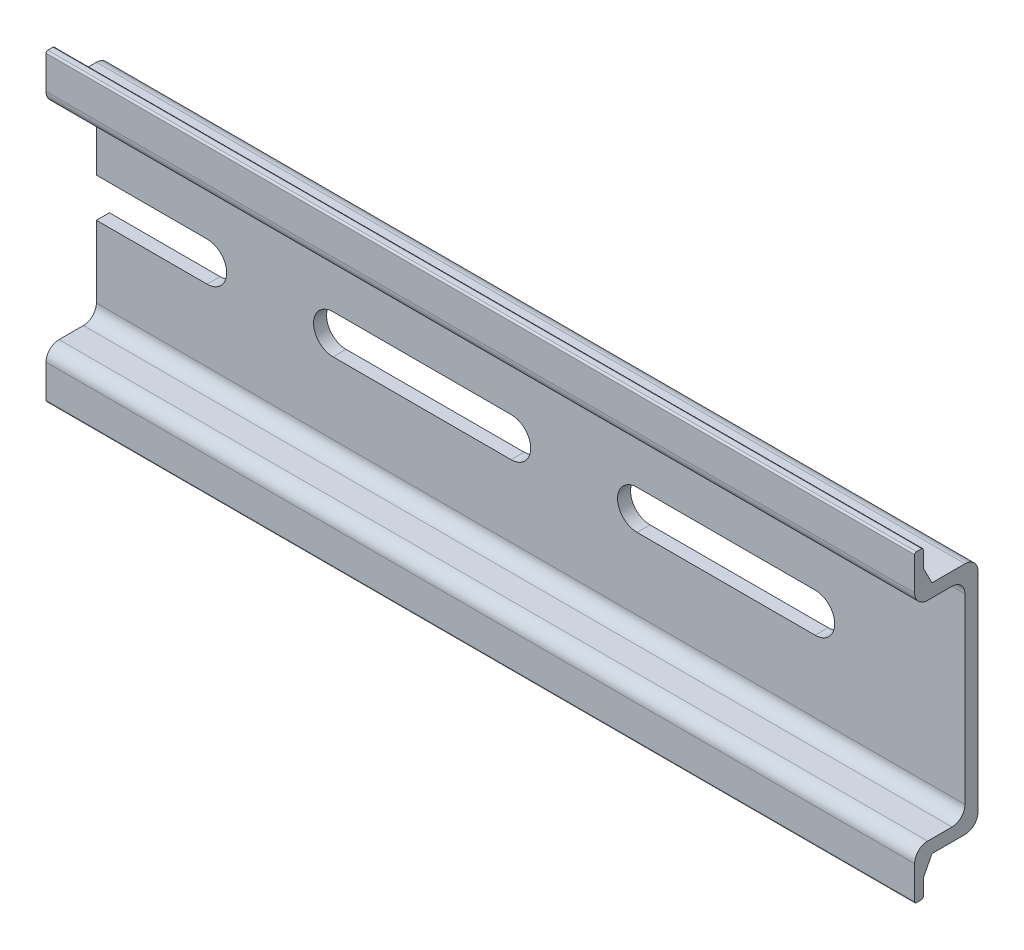
from build123d import *

# Parameters (mm, degrees)
BOSS_EXTRUDE1_DEPTH = 100
CUT_EXTRUDE1_DEPTH  = 102.78182549
LPATTERN1_COUNT     = 3
LPATTERN1_PITCH     = 35


with BuildPart() as part:
    # Sketch1 → Boss-Extrude1 (new body)
    with BuildSketch(Plane(origin=(0, 0, 0), x_dir=(0, 0, -1), z_dir=(1, 0, 0))):
        with BuildLine():
            Line((-6.5, 17.5), (-7.1, 17.5))
            ThreePointArc((-7.1, 17.5), (-7.241421356, 17.441421356), (-7.3, 17.3))
            Line((-7.3, 17.3), (-7.3, 13.5))
            ThreePointArc((-7.3, 13.5), (-6.860660172, 12.439339828), (-5.8, 12))
            Line((-5.8, 12), (-3, 12))
            ThreePointArc((-3, 12), (-1.939339828, 11.560660172), (-1.5, 10.5))
            Line((-1.5, 10.5), (-1.5, -10.5))
            ThreePointArc((-1.5, -10.5), (-1.939339828, -11.560660172), (-3, -12))
            Line((-3, -12), (-5.8, -12))
            ThreePointArc((-5.8, -12), (-6.860660172, -12.439339828), (-7.3, -13.5))
            Line((-7.3, -13.5), (-7.3, -17.3))
            ThreePointArc((-7.3, -17.3), (-7.241421356, -17.441421356), (-7.1, -17.5))
            Line((-7.1, -17.5), (-6.5, -17.5))
            ThreePointArc((-6.5, -17.5), (-6.358578644, -17.441421356), (-6.3, -17.3))
            Line((-6.3, -17.3), (-6.3, -15.462610506))
            Line((-6.3, -15.462610506), (-5.3, -13.5))
            Line((-5.3, -13.5), (-1.5, -13.5))
            ThreePointArc((-1.5, -13.5), (-0.439339828, -13.060660172), (0, -12))
            Line((0, -12), (0, 12))
            ThreePointArc((0, 12), (-0.439339828, 13.060660172), (-1.5, 13.5))
            Line((-1.5, 13.5), (-5.3, 13.5))
            Line((-5.3, 13.5), (-6.3, 15.462610506))
            Line((-6.3, 15.462610506), (-6.3, 17.3))
            ThreePointArc((-6.3, 17.3), (-6.358578644, 17.441421356), (-6.5, 17.5))
        make_face()
    extrude(amount=BOSS_EXTRUDE1_DEPTH)

    # Sketch2 → Cut-Extrude1 (cut, through all)
    with BuildSketch(Plane.XY):
        with BuildLine():
            Line((62.25, 2.25), (82.75, 2.25))
            ThreePointArc((82.75, 2.25), (85, 0), (82.75, -2.25))
            Line((82.75, -2.25), (62.25, -2.25))
            ThreePointArc((62.25, -2.25), (60, 0), (62.25, 2.25))
        make_face()
    cut_extrude1 = extrude(amount=CUT_EXTRUDE1_DEPTH, mode=Mode.SUBTRACT)

    # LPattern1: Cut-Extrude1 ×3
    with Locations(*[(-i * LPATTERN1_PITCH, 0, 0) for i in range(1, LPATTERN1_COUNT)]):
        add(cut_extrude1, mode=Mode.SUBTRACT)


solid = part.part
